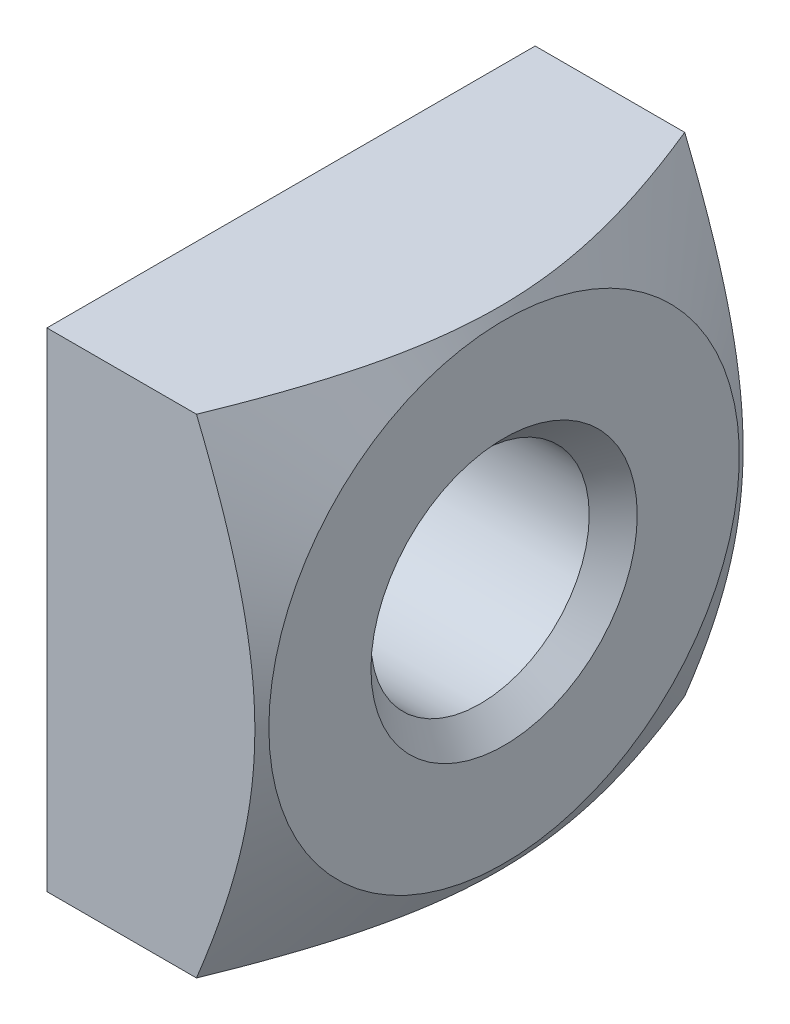
from build123d import *

# Parameters (mm, degrees)
SKETCH2_R          = 5
SKETCH2_W          = 5.5
SKETCH2_H          = 5.5
CUT_EXTRUDE1_DEPTH = 6


with BuildPart() as part:
    # Sketch1 → Revolve1 (revolve)
    with BuildSketch(Plane.XY, mode=Mode.PRIVATE) as revolve1_sk:
        Polygon((0, 0), (0, 3.9), (1.678312164, 3.9), (2.4, 2.65), (2.4, 0), align=None)
    revolve(revolve1_sk.sketch.rotate(Axis((2.4, 0, 0), (-1, 0, 0)), 270), axis=Axis((2.4, 0, 0), (-1, 0, 0)))

    # Sketch2 → Cut-Extrude1 (cut)
    with BuildSketch(Plane(origin=(0, 0, 0), x_dir=(0, 0, -1), z_dir=(1, 0, 0))):
        Circle(SKETCH2_R)
        Rectangle(SKETCH2_W, SKETCH2_H, mode=Mode.SUBTRACT)
    extrude(amount=CUT_EXTRUDE1_DEPTH, mode=Mode.SUBTRACT)

    # Sketch3 → Cut-Revolve1 (revolve, cut)
    with BuildSketch(Plane.XY, mode=Mode.PRIVATE) as cut_revolve1_sk:
        Polygon((0, 0), (0, 1.5), (0.2705, 1.2295), (2.1295, 1.2295), (2.4, 1.5), (2.4, 0), align=None)
    revolve(cut_revolve1_sk.sketch.rotate(Axis((2.4, 0, 0), (-1, 0, 0)), 270), axis=Axis((2.4, 0, 0), (-1, 0, 0)), mode=Mode.SUBTRACT)


solid = part.part
